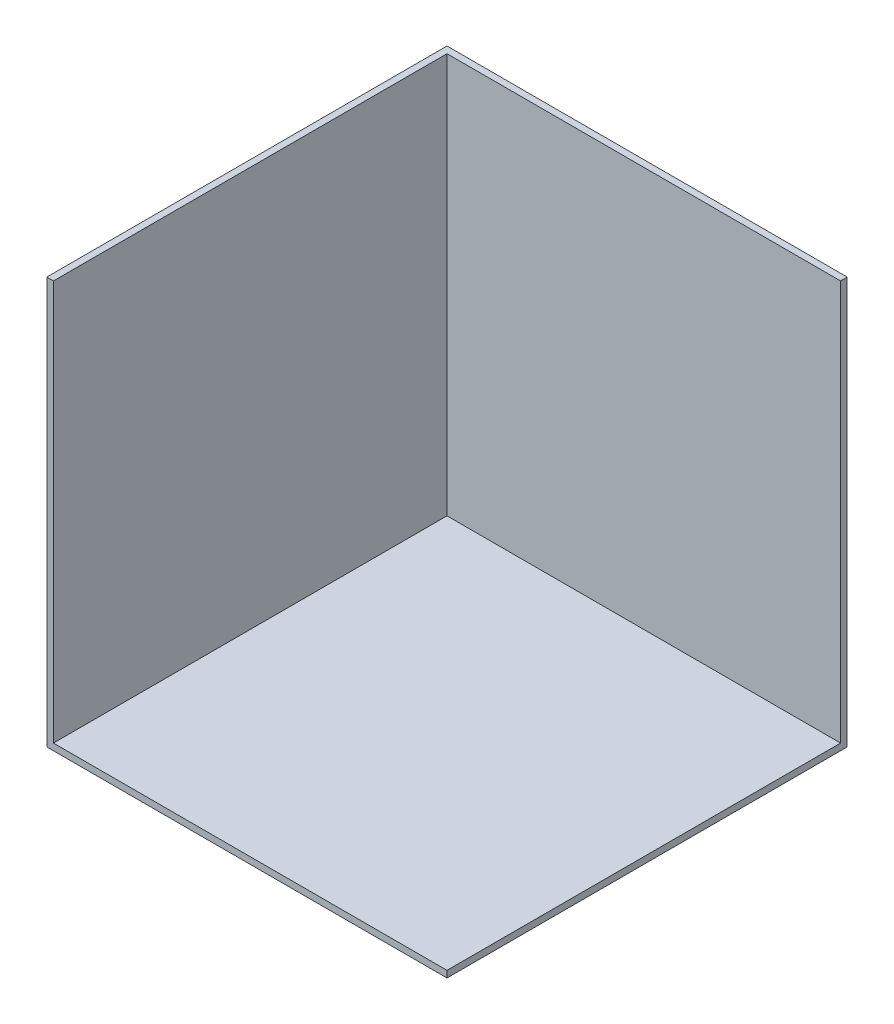
from build123d import *

# Parameters (mm, degrees)
SKETCH1_W           = 6000
SKETCH1_H           = 6000
BOSS_EXTRUDE2_DEPTH = 100
BOSS_EXTRUDE3_DEPTH = 6000


with BuildPart() as part:
    # Sketch1 → Boss-Extrude2 (new body)
    with BuildSketch(Plane(origin=(0, 0, 0), x_dir=(1, 0, 0), z_dir=(0, 1, 0))):
        Rectangle(SKETCH1_W, SKETCH1_H)
    extrude(amount=BOSS_EXTRUDE2_DEPTH)

    # Sketch2 → Boss-Extrude3 (add)
    with BuildSketch(Plane(origin=(0, 100, 0), x_dir=(1, 0, 0), z_dir=(0, 1, 0))):
        Polygon((3000, 2900), (-2900, 2900), (-2900, -3000), (-3000, -3000), (-3000, 3000), (3000, 3000), align=None)
    extrude(amount=BOSS_EXTRUDE3_DEPTH)


solid = part.part
